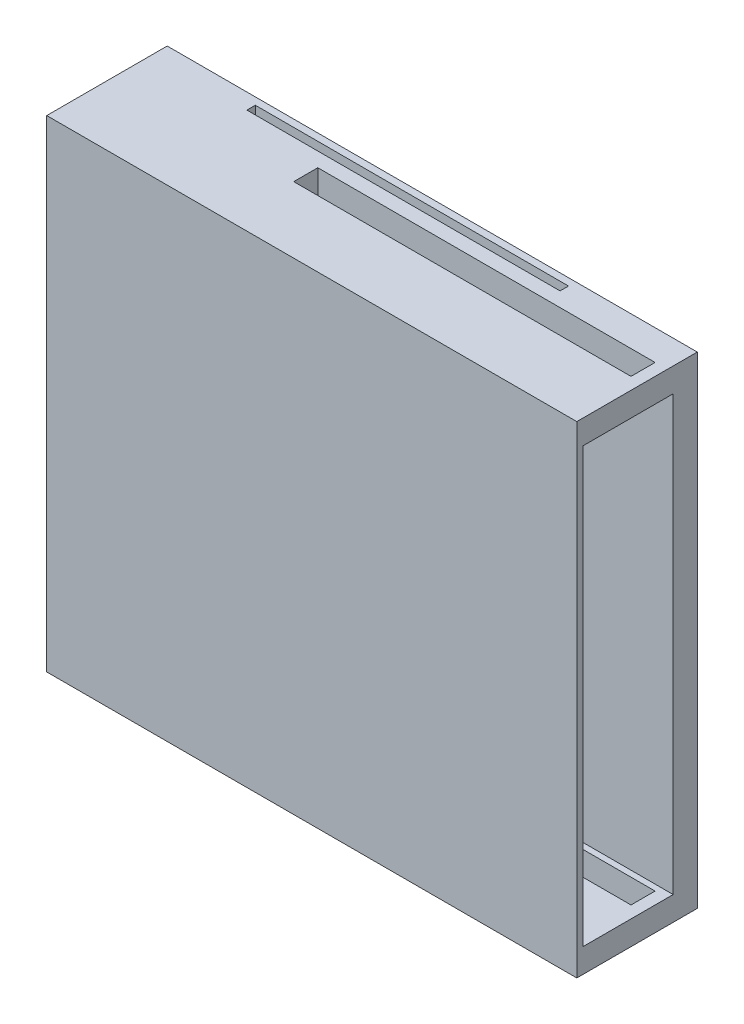
from build123d import *

# Parameters (mm, degrees)
SKETCH1_W           = 440
SKETCH1_H           = 100
SKETCH1_W_2         = 280
SKETCH1_H_2         = 20
SKETCH1_W_3         = 260
SKETCH1_H_3         = 7
BOSS_EXTRUDE1_DEPTH = 20
SKETCH8_W           = 440
SKETCH8_H           = 5
BOSS_EXTRUDE2_DEPTH = 360
LPATTERN2_COUNT     = 2
LPATTERN2_PITCH     = 380
SKETCH10_W          = 440
SKETCH10_H          = 20
BOSS_EXTRUDE3_DEPTH = 360
SKETCH11_W          = 259.997812745
SKETCH11_H          = 3
CUT_EXTRUDE1_DEPTH  = 1.5
CUT_EXTRUDE2_DEPTH  = 1.5
SKETCH17_W          = 260
SKETCH17_H          = 3
CUT_EXTRUDE3_DEPTH  = 1.5
SKETCH18_W          = 260
SKETCH18_H          = 3
CUT_EXTRUDE4_DEPTH  = 1.5


with BuildPart() as part:
    # Sketch1 → Boss-Extrude1 (new body)
    with BuildSketch(Plane(origin=(0, 0, 0), x_dir=(1, 0, 0), z_dir=(0, 1, 0))):
        Rectangle(SKETCH1_W, SKETCH1_H)
        with Locations((70, 14.99604314)):
            Rectangle(SKETCH1_W_2, SKETCH1_H_2, mode=Mode.SUBTRACT)
        with Locations((-10.87698902, 40.5)):
            Rectangle(SKETCH1_W_3, SKETCH1_H_3, mode=Mode.SUBTRACT)
    boss_extrude1 = extrude(amount=BOSS_EXTRUDE1_DEPTH)

    # Sketch8 → Boss-Extrude2 (add)
    with BuildSketch(Plane.XZ):
        with Locations((0, 47.5)):
            Rectangle(SKETCH8_W, SKETCH8_H)
    extrude(amount=BOSS_EXTRUDE2_DEPTH)

    # LPattern2: Boss-Extrude1 ×2
    with Locations(*[(0, -i * LPATTERN2_PITCH, 0) for i in range(1, LPATTERN2_COUNT)]):
        add(boss_extrude1)

    # Sketch10 → Boss-Extrude3 (add)
    with BuildSketch(Plane.XZ):
        with Locations((0, -40)):
            Rectangle(SKETCH10_W, SKETCH10_H)
    extrude(amount=BOSS_EXTRUDE3_DEPTH)

    # Sketch11 → Cut-Extrude1 (cut)
    with BuildSketch(Plane(origin=(0, 0, -37), x_dir=(-1, 0, 0), z_dir=(0, 0, -1))):
        with Locations((10.878082647, 10)):
            Rectangle(SKETCH11_W, SKETCH11_H)
    extrude(amount=-CUT_EXTRUDE1_DEPTH, mode=Mode.SUBTRACT)

    # Sketch16 → Cut-Extrude2 (cut)
    with BuildSketch(Plane.XY.offset(-44)):
        Polygon((-140.87698902, 11.5), (119.12301098, 11.5), (119.12301098, 8.5), (-140.881315907, 8.5), align=None)
    extrude(amount=-CUT_EXTRUDE2_DEPTH, mode=Mode.SUBTRACT)

    # Sketch17 → Cut-Extrude3 (cut)
    with BuildSketch(Plane(origin=(0, 0, -37), x_dir=(-1, 0, 0), z_dir=(0, 0, -1))):
        with Locations((10.87698902, -370)):
            Rectangle(SKETCH17_W, SKETCH17_H)
    extrude(amount=-CUT_EXTRUDE3_DEPTH, mode=Mode.SUBTRACT)

    # Sketch18 → Cut-Extrude4 (cut)
    with BuildSketch(Plane.XY.offset(-44)):
        with Locations((-10.87698902, -370)):
            Rectangle(SKETCH18_W, SKETCH18_H)
    extrude(amount=-CUT_EXTRUDE4_DEPTH, mode=Mode.SUBTRACT)


solid = part.part
